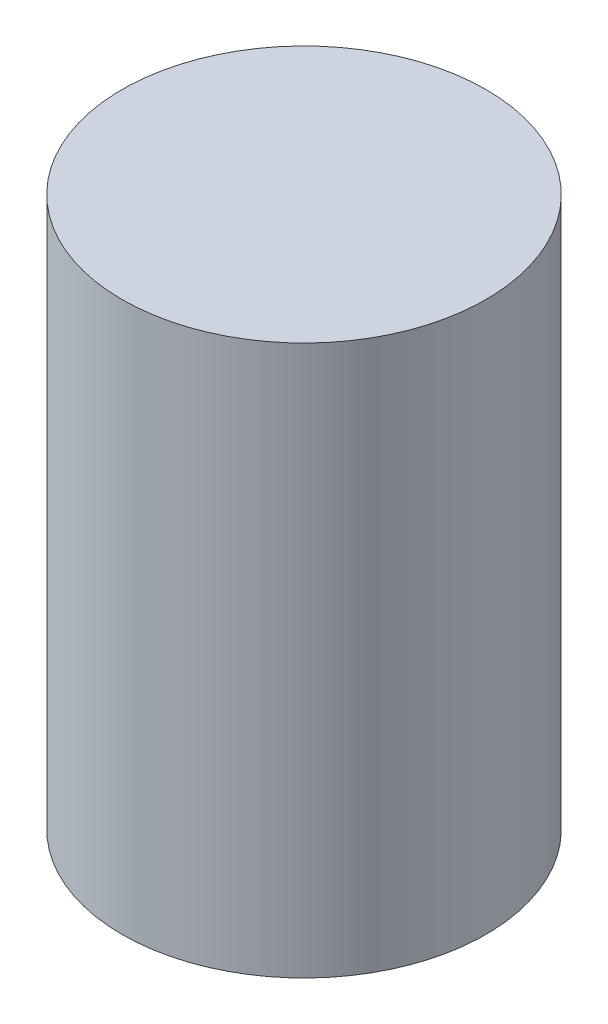
from build123d import *

# Parameters (mm, degrees)
CURVESKETCH_R   = 9.137
CURVEBOSS_DEPTH = 27.617


with BuildPart() as part:
    # CurveSketch → CurveBoss (new body)
    with BuildSketch(Plane(origin=(0, 0, 0), x_dir=(1, 0, 0), z_dir=(0, 1, 0))):
        with Locations(Location((-7.137, 2.617, 0), (0, 0, 270))):
            Circle(CURVESKETCH_R)
    extrude(amount=-CURVEBOSS_DEPTH)


solid = part.part
